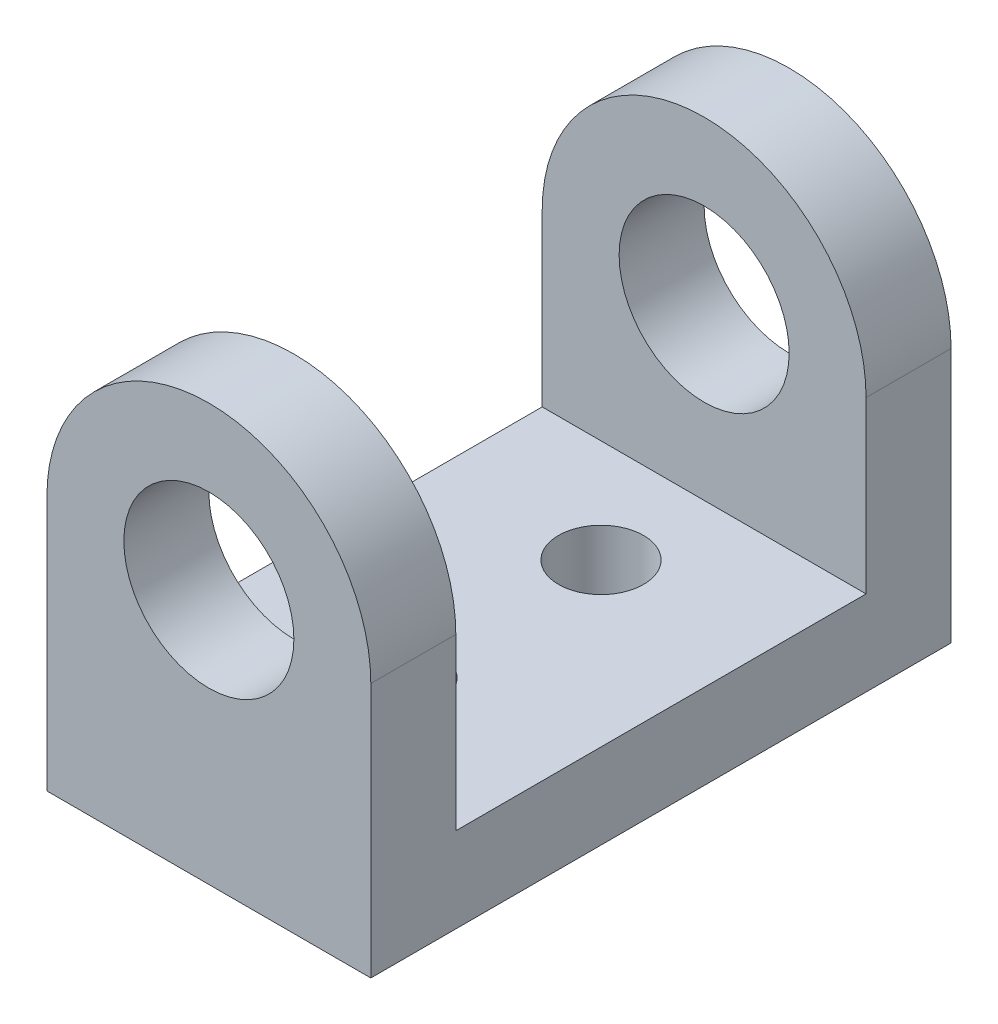
from build123d import *

# Parameters (mm, degrees)
SKETCH1_R           = 9.525
SKETCH1_R_2         = 5
BOSS_EXTRUDE1_DEPTH = 34.13
SKETCH2_W           = 24.13
SKETCH2_H           = 19.525
CUT_EXTRUDE1_DEPTH  = 42.865969474
SKETCH3_R           = 2.5
CUT_EXTRUDE2_DEPTH  = 41.45748571


with BuildPart() as part:
    # Sketch1 → Boss-Extrude1 (new body)
    # profile 1 of 2: a face of its own
    with BuildSketch(Plane.XY):
        Circle(SKETCH1_R)
        Circle(SKETCH1_R_2, mode=Mode.SUBTRACT)
    # profile 2 of 2: a face of its own
    with BuildSketch(Plane.XY):
        with BuildLine():
            ThreePointArc((9.525, 0), (0, -9.525), (-9.525, 0))
            Line((-9.525, 0), (-9.525, -15))
            Line((-9.525, -15), (9.525, -15))
            Line((9.525, -15), (9.525, 0))
        make_face()
    extrude(amount=BOSS_EXTRUDE1_DEPTH)

    # Sketch2 → Cut-Extrude1 (cut, through all)
    with BuildSketch(Plane(origin=(9.525, 0, 0), x_dir=(0, 0, -1), z_dir=(1, 0, 0))):
        with Locations((-17.065, -0.2375)):
            Rectangle(SKETCH2_W, SKETCH2_H)
    extrude(amount=-CUT_EXTRUDE1_DEPTH, mode=Mode.SUBTRACT)

    # Sketch3 → Cut-Extrude2 (cut, through all)
    with BuildSketch(Plane(origin=(0, -10, 0), x_dir=(1, 0, 0), z_dir=(0, 1, 0))):
        with Locations(Location((0, -11.065, 0), (0, 0, 180))):
            Circle(SKETCH3_R)
        with Locations((0, -23.065)):
            Circle(SKETCH3_R)
    extrude(amount=-CUT_EXTRUDE2_DEPTH, mode=Mode.SUBTRACT)


solid = part.part
